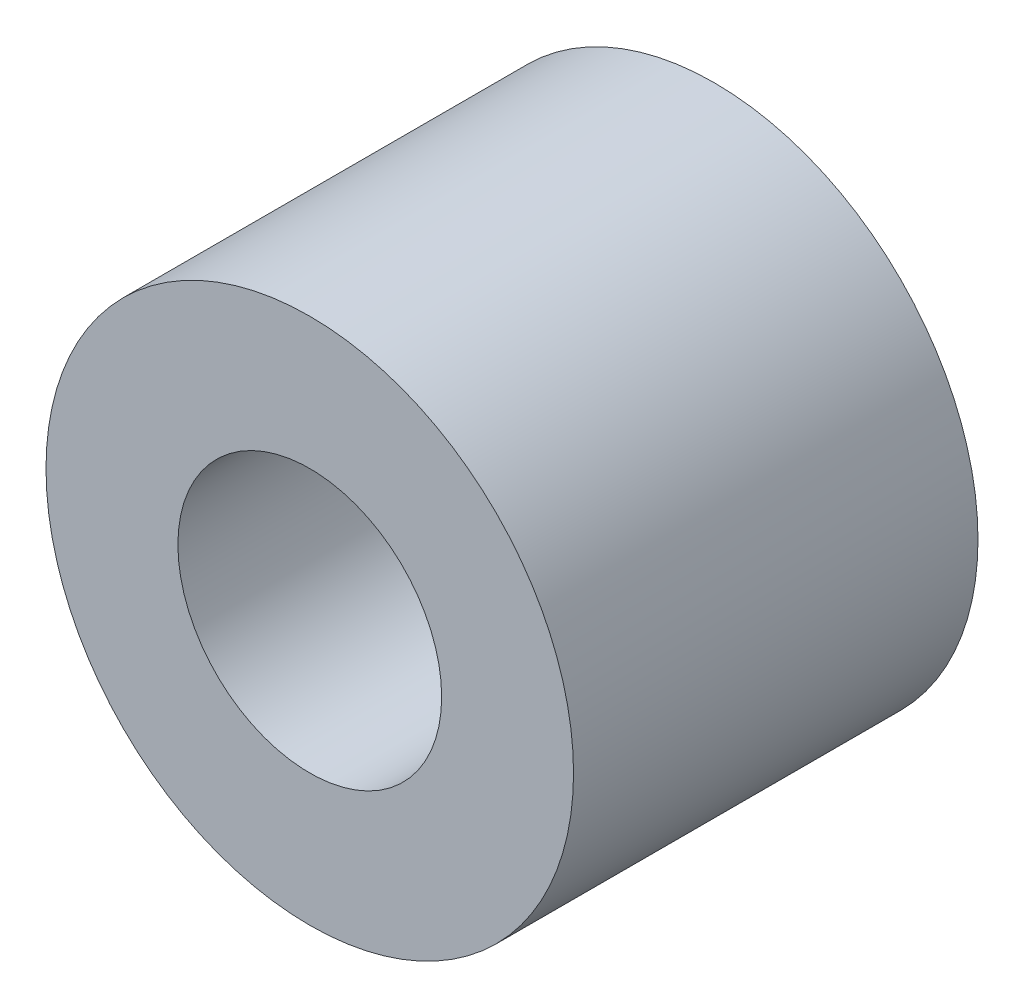
from build123d import *

# Parameters (mm, degrees)
SKETCH_1_R      = 4.5
SKETCH_1_R_2    = 2.25
EXTRUDE_1_DEPTH = 6.9


with BuildPart() as part:
    # 草图1 → 凸台-拉伸1 (new body)
    with BuildSketch(Plane.XY):
        with Locations(Location((0, 0, 0), (0, 0, 180))):
            Circle(SKETCH_1_R)
        with Locations(Location((0, 0, 0), (0, 0, 180))):
            Circle(SKETCH_1_R_2, mode=Mode.SUBTRACT)
    extrude(amount=EXTRUDE_1_DEPTH)


solid = part.part
